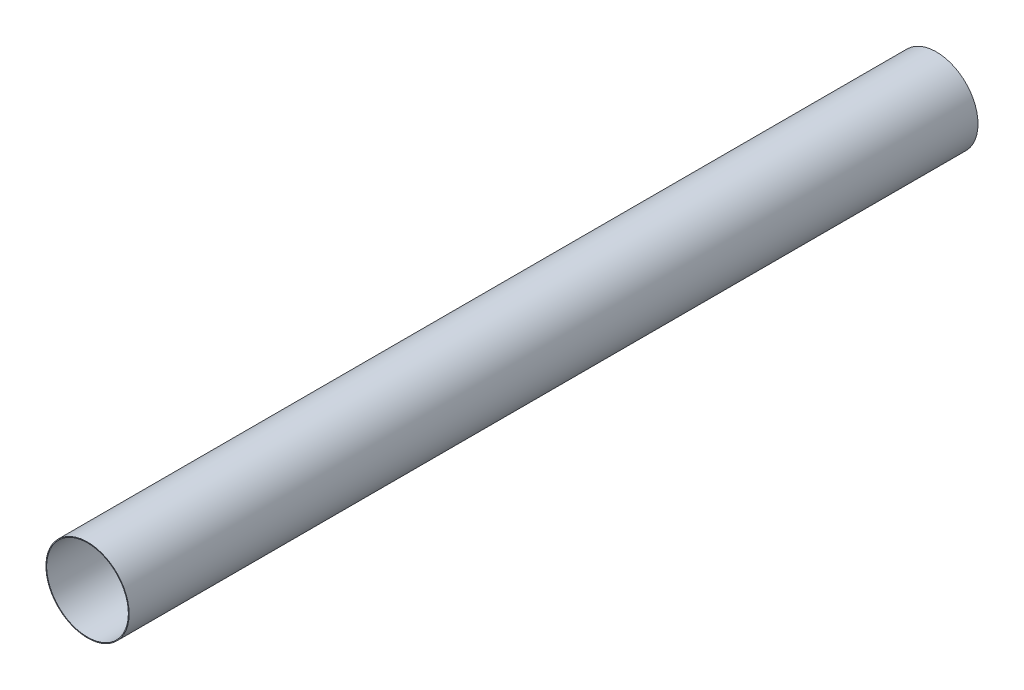
from build123d import *

# Parameters (mm, degrees)
SKETCH1_R           = 56
SKETCH1_R_2         = 55
BOSS_EXTRUDE1_DEPTH = 1143


with BuildPart() as part:
    # Sketch1 → Boss-Extrude1 (new body)
    with BuildSketch(Plane.XY):
        Circle(SKETCH1_R)
        Circle(SKETCH1_R_2, mode=Mode.SUBTRACT)
    extrude(amount=BOSS_EXTRUDE1_DEPTH)


solid = part.part
